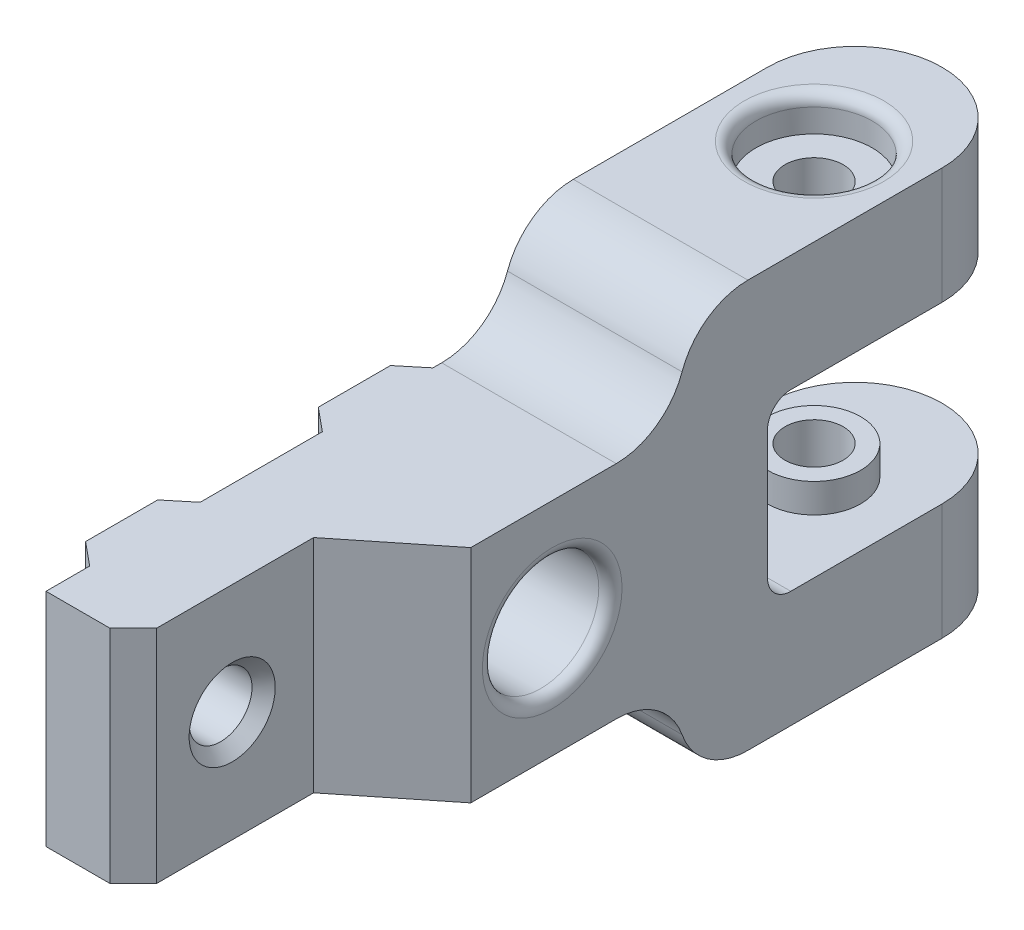
from build123d import *

# Parameters (mm, degrees)
SKETCH_1_W               = 59
SKETCH_1_H               = 15
EXTRUDE_1_DEPTH          = 5
SKETCH_2_R               = 2.5
CUT_EXTRUDE_1_DEPTH      = 31.84639363
SKETCH_3_W               = 9.5
SKETCH_3_H               = 15
EXTRUDE_2_DEPTH          = 2
CUT_EXTRUDE_2_DEPTH      = 34.826764551
CUT_EXTRUDE_2_DEPTH_BACK = 34.826764551
SKETCH_5_R               = 2.5
CUT_EXTRUDE_3_DEPTH      = 32.232995373
SKETCH_7_R               = 2.5
CUT_EXTRUDE_4_DEPTH      = 32.232995373
SKETCH_8_W               = 15
SKETCH_8_H               = 15
EXTRUDE_3_DEPTH          = 38.5
SKETCH_13_W              = 9.5
SKETCH_13_H              = 15
EXTRUDE_4_DEPTH          = 2
CUT_EXTRUDE_5_DEPTH      = 55.658027773
SKETCH_15_R              = 2.5
CUT_EXTRUDE_6_DEPTH      = 62.276014883
CUT_EXTRUDE_7_DEPTH      = 55.658027773
CHAMFER_1_SIZE           = 2
CHAMFER_2_SIZE           = 2
CHAMFER_3_SIZE           = 1
CHAMFER_4_SIZE           = 1
CHAMFER_5_SIZE           = 1
CHAMFER_6_SIZE           = 1
CUT_EXTRUDE_8_DEPTH      = 55.658027773
EXTRUDE_5_DEPTH          = 15
SKETCH_19_R              = 2.5
CUT_EXTRUDE_9_DEPTH      = 62.276014883
SKETCH_20_R              = 4
CUT_EXTRUDE_10_DEPTH     = 5
EXTRUDE_6_DEPTH          = 15
CUT_EXTRUDE_11_DEPTH     = 15
SKETCH_23_R              = 11
CUT_EXTRUDE_12_DEPTH     = 55.658027773
FILLET_2_R               = 7
SKETCH_24_W              = 4
SKETCH_24_H              = 15
CUT_EXTRUDE_14_DEPTH     = 55.658027773
EXTRUDE_7_DEPTH          = 15
SKETCH_26_R              = 2.5
CUT_EXTRUDE_15_DEPTH     = 55.658027773
FILLET_3_RADIUS          = 7.5
FILLET_3_LENGTH          = 15
SKETCH_27_W              = 25.515520857
SKETCH_27_H              = 10.25
CUT_EXTRUDE_16_DEPTH     = 55.658027773
SKETCH_29_R              = 2.65
CUT_EXTRUDE_17_DEPTH     = 48.302219821
SKETCH_30_R              = 2.5
EXTRUDE_8_DEPTH          = 20
SKETCH_31_W              = 11
SKETCH_31_H              = 15
CUT_EXTRUDE_18_DEPTH     = 55.198708472
EXTRUDE_9_REACH          = 56.199
SKETCH_35_R              = 3
SKETCH_35_R_2            = 2.75
SKETCH_36_W              = 10.932925362
SKETCH_36_H              = 11.739598214
EXTRUDE_10_DEPTH         = 4
SKETCH_37_R              = 4.898045624
CUT_EXTRUDE_19_DEPTH     = 7.5
CUT_EXTRUDE_20_DEPTH     = 8
CUT_EXTRUDE_21_DEPTH     = 8
SKETCH_39_W              = 7.820563766
SKETCH_39_H              = 12.633218391
EXTRUDE_11_DEPTH         = 8
CUT_EXTRUDE_22_DEPTH     = 55.198708472
SKETCH_41_R              = 5
CUT_EXTRUDE_23_DEPTH     = 8
FILLET_4_R               = 1
CHAMFER_8_SIZE           = 1
FILLET_6_R               = 6
SKETCH_43_W              = 13
SKETCH_43_H              = 15
CUT_EXTRUDE_25_DEPTH     = 55.198708472
SKETCH_46_W              = 2
SKETCH_46_H              = 15
CUT_EXTRUDE_26_DEPTH     = 55.198708472
FILLET_8_R               = 2
SKETCH_48_R              = 4
SKETCH_48_R_2            = 2.5
EXTRUDE_12_DEPTH         = 15
SKETCH_49_W              = 15.94941223
SKETCH_49_H              = 10
CUT_EXTRUDE_27_DEPTH     = 55.198708472
EXTRUDE_14_DEPTH         = 8
EXTRUDE_14_DEPTH_BACK    = 8
SKETCH_51_R              = 2.5
SKETCH_52_R              = 2.5
CUT_EXTRUDE_28_DEPTH     = 8
FILLET_9_R               = 6
SKETCH_54_R              = 4.75
CUT_EXTRUDE_29_DEPTH     = 2
CUT_EXTRUDE_30_DEPTH     = 4
SKETCH_56_R              = 5
CUT_EXTRUDE_31_DEPTH     = 3
FILLET_10_R              = 1


with BuildPart() as part:
    # Эскиз1 → Бобышка-Вытянуть1 (new body)
    with BuildSketch(Plane.XY):
        Rectangle(SKETCH_1_W, SKETCH_1_H)
    extrude(amount=EXTRUDE_1_DEPTH)

    # Эскиз2 → Вырез-Вытянуть1 (cut, through all)
    with BuildSketch(Plane(origin=(0, 0, 0), x_dir=(-1, 0, 0), z_dir=(0, 0, -1))):
        with BuildLine():
            ThreePointArc((23.5, 0), (21, 2.5), (18.5, 0))
            Line((18.5, 0), (21, 0))
            Line((21, 0), (23.5, 0))
        make_face()
        with BuildLine():
            Line((21, 0), (18.5, 0))
            ThreePointArc((18.5, 0), (21, -2.5), (23.5, 0))
            Line((23.5, 0), (21, 0))
        make_face()
        with Locations((-21, 0)):
            Circle(SKETCH_2_R)
    extrude(amount=-CUT_EXTRUDE_1_DEPTH, mode=Mode.SUBTRACT)

    # Эскиз3 → Бобышка-Вытянуть2 (add)
    with BuildSketch(Plane.XY.offset(5)):
        with Locations((-21, 0)):
            Rectangle(SKETCH_3_W, SKETCH_3_H)
        with Locations((21, 0)):
            Rectangle(SKETCH_3_W, SKETCH_3_H)
    extrude(amount=EXTRUDE_2_DEPTH)

    # Эскиз4 → Вырез-Вытянуть2 (cut, two sides: drawn at the far end of the back side and taken through both)
    with BuildSketch(Plane.XZ.offset(7.5).offset(-CUT_EXTRUDE_2_DEPTH_BACK)):
        Polygon((-16.25, 7), (-17.9, 7), (-16.25, 5), align=None)
        Polygon((-25.75, 5), (-24.1, 7), (-25.75, 7), align=None)
    extrude(amount=CUT_EXTRUDE_2_DEPTH + CUT_EXTRUDE_2_DEPTH_BACK, mode=Mode.SUBTRACT)

    # Эскиз5 → Вырез-Вытянуть3 (cut, through all)
    with BuildSketch(Plane(origin=(0, 0, 0), x_dir=(-1, 0, 0), z_dir=(0, 0, -1))):
        with Locations((21, 0)):
            Circle(SKETCH_5_R)
    extrude(amount=-CUT_EXTRUDE_3_DEPTH, mode=Mode.SUBTRACT)

    # Эскиз7 → Вырез-Вытянуть4 (cut, through all)
    with BuildSketch(Plane(origin=(0, 0, 0), x_dir=(-1, 0, 0), z_dir=(0, 0, -1))):
        with Locations((-21, 0)):
            Circle(SKETCH_7_R)
    extrude(amount=-CUT_EXTRUDE_4_DEPTH, mode=Mode.SUBTRACT)

    # Эскиз8 → Бобышка-Вытянуть3 (add)
    with BuildSketch(Plane.XY.offset(5)):
        with Locations((-3.5, 0)):
            Rectangle(SKETCH_8_W, SKETCH_8_H)
    extrude(amount=EXTRUDE_3_DEPTH)

    # Эскиз13 → Бобышка-Вытянуть4 (add)
    with BuildSketch(Plane.ZY.offset(11)):
        with Locations((15, 0)):
            Rectangle(SKETCH_13_W, SKETCH_13_H)
        with Locations((35, 0)):
            Rectangle(SKETCH_13_W, SKETCH_13_H)
    extrude(amount=EXTRUDE_4_DEPTH)

    # Эскиз14 → Вырез-Вытянуть5 (cut, through all)
    with BuildSketch(Plane.XZ.offset(7.5)):
        Polygon((-13, 39.75), (-13, 38.1), (-11, 39.75), align=None)
        Polygon((-11, 30.25), (-13, 31.9), (-13, 30.25), align=None)
        Polygon((-13, 19.75), (-13, 18.1), (-11, 19.75), align=None)
        Polygon((-11, 10.25), (-13, 11.9), (-13, 10.25), align=None)
    extrude(amount=-CUT_EXTRUDE_5_DEPTH, mode=Mode.SUBTRACT)

    # Эскиз15 → Вырез-Вытянуть6 (cut, through all)
    with BuildSketch(Plane.ZY.offset(13)):
        with Locations((15, 0)):
            Circle(SKETCH_15_R)
        with Locations((35, 0)):
            Circle(SKETCH_15_R)
    extrude(amount=-CUT_EXTRUDE_6_DEPTH, mode=Mode.SUBTRACT)

    # Эскиз16 → Вырез-Вытянуть7 (cut, through all)
    with BuildSketch(Plane(origin=(0, 7.5, 0), x_dir=(1, 0, 0), z_dir=(0, 1, 0))):
        Polygon((4, -43.5), (4, -22), (-3.5, -28), (-3.5, -43.5), align=None)
    extrude(amount=-CUT_EXTRUDE_7_DEPTH, mode=Mode.SUBTRACT)

    # Фаска1
    chamfer_1_edges = [part.edges().sort_by_distance(p)[0] for p in [
        (-3.5, 0, 43.5),
    ]]
    chamfer(chamfer_1_edges, length=CHAMFER_1_SIZE)

    # Фаска2
    chamfer_2_edges = [part.edges().sort_by_distance(p)[0] for p in [
        (29.5, 0, 5),
    ]]
    chamfer(chamfer_2_edges, length=CHAMFER_2_SIZE)

    # Фаска3
    chamfer_3_edges = [part.edges().sort_by_distance(p)[0] for p in [
        (25.75, 0, 7),
    ]]
    chamfer(chamfer_3_edges, length=CHAMFER_3_SIZE)

    # Фаска4
    chamfer_4_edges = [part.edges().sort_by_distance(p)[0] for p in [
        (16.25, 0, 7),
    ]]
    chamfer(chamfer_4_edges, length=CHAMFER_4_SIZE)

    # Фаска5
    chamfer_5_edges = [part.edges().sort_by_distance(p)[0] for p in [
        (29.5, 0, 0),
    ]]
    chamfer(chamfer_5_edges, length=CHAMFER_5_SIZE)

    # Фаска6
    chamfer_6_edges = [part.edges().sort_by_distance(p)[0] for p in [
        (-29.5, 0, 0),
    ]]
    chamfer(chamfer_6_edges, length=CHAMFER_6_SIZE)

    # Эскиз17 → Вырез-Вытянуть8 (cut, through all)
    with BuildSketch(Plane.XZ.offset(7.5)):
        Polygon((-11, 5), (4, 5), (4, 22), (-3.5, 28), (-3.5, 41.5), (-5.5, 43.5), (-11, 43.5), (-11, 39.75), (-13, 38.1), (-13, 31.9), (-11, 30.25), (-11, 19.75), (-13, 18.1), (-13, 11.9), (-11, 10.25), align=None)
    extrude(amount=-CUT_EXTRUDE_8_DEPTH, mode=Mode.SUBTRACT)

    # Эскиз18 → Бобышка-Вытянуть5 (add)
    with BuildSketch(Plane.XZ.offset(7.5)):
        Polygon((-11, 5), (4, 5), (4, 22), (-3.5, 28), (-3.5, 41.5), (-5.5, 43.5), (-11, 43.5), (-11, 39.75), (-13, 38.1), (-13, 31.9), (-11, 30.25), (-11, 19.75), (-13, 18.1), (-13, 11.9), (-11, 10.25), align=None)
    extrude(amount=-EXTRUDE_5_DEPTH)

    # Эскиз19 → Вырез-Вытянуть9 (cut, through all)
    with BuildSketch(Plane.ZY.offset(13)):
        with Locations((15, 0)):
            Circle(SKETCH_19_R)
        with Locations((35, 0)):
            Circle(SKETCH_19_R)
    extrude(amount=-CUT_EXTRUDE_9_DEPTH, mode=Mode.SUBTRACT)

    # Эскиз20 → Вырез-Вытянуть10 (cut)
    with BuildSketch(Plane(origin=(4, 0, 0), x_dir=(0, 0, -1), z_dir=(1, 0, 0))):
        with Locations((-15, 0)):
            Circle(SKETCH_20_R)
    extrude(amount=-CUT_EXTRUDE_10_DEPTH, mode=Mode.SUBTRACT)

    # Эскиз21 → Бобышка-Вытянуть6 (add)
    with BuildSketch(Plane(origin=(0, 7.5, 0), x_dir=(1, 0, 0), z_dir=(0, 1, 0))):
        with BuildLine():
            Line((15, 15), (15, 0))
            Line((15, 0), (-15, 0))
            Line((-15, 0), (-15, 15))
            ThreePointArc((-15, 15), (0, 30), (15, 15))
        make_face()
    extrude(amount=-EXTRUDE_6_DEPTH)

    # Эскиз22 → Вырез-Вытянуть11 (cut)
    with BuildSketch(Plane(origin=(0, 7.5, 0), x_dir=(1, 0, 0), z_dir=(0, 1, 0))):
        Polygon((15, 0), (15, -5), (16.25, -5), (16.25, -6), (17.25, -7), (24.75, -7), (25.75, -6), (25.75, -5), (27.5, -5), (29.5, -3), (29.5, -1), (28.5, 0), align=None)
    extrude(amount=-CUT_EXTRUDE_11_DEPTH, mode=Mode.SUBTRACT)

    # Эскиз23 → Вырез-Вытянуть12 (cut, through all)
    with BuildSketch(Plane(origin=(0, 7.5, 0), x_dir=(1, 0, 0), z_dir=(0, 1, 0))):
        with Locations(Location((0, 15, 0), (0, 0, 270))):
            Circle(SKETCH_23_R)
    extrude(amount=-CUT_EXTRUDE_12_DEPTH, mode=Mode.SUBTRACT)

    # Скругление2
    fillet_2_edges = [part.edges().sort_by_distance(p)[0] for p in [
        (15, 0, 5),
    ]]
    fillet(fillet_2_edges, radius=FILLET_2_R)

    # Эскиз24 → Вырез-Вытянуть14 (cut, through all)
    with BuildSketch(Plane.XZ.offset(7.5)):
        with BuildLine():
            Line((11, -15), (15, -15))
            Line((15, -15), (15, -2))
            ThreePointArc((15, -2), (12.949747468, 2.949747468), (8, 5))
            Line((8, 5), (4, 5))
            Line((4, 5), (4, -4.753049234))
            ThreePointArc((4, -4.753049234), (9.082951062, -8.795163177), (11, -15))
        make_face()
        with BuildLine():
            ThreePointArc((-10.198039027, -26), (6.001225483, -28.747192175), (15, -15))
            Line((15, -15), (11, -15))
            ThreePointArc((11, -15), (9.082951062, -21.204836823), (4, -25.246950766))
            Line((4, -25.246950766), (4, -26))
            Line((4, -26), (0, -26))
            Line((0, -26), (-10.198039027, -26))
        make_face()
        with BuildLine():
            ThreePointArc((-15, -15), (-13.964240044, -20.477225575), (-11, -25.198039027))
            Line((-11, -25.198039027), (-11, -15))
            Line((-11, -15), (-15, -15))
        make_face()
        with Locations((-13, -7.5)):
            Rectangle(SKETCH_24_W, SKETCH_24_H)
    extrude(amount=-CUT_EXTRUDE_14_DEPTH, mode=Mode.SUBTRACT)


with BuildPart() as cut_extrude_14_piece_1:
    # of the separate pieces the step leaves, piece 1, a body of its own (cut_extrude_14_pieces)
    add(part.part.solids().sort_by_distance((4, 7.5, 22))[0])



with BuildPart() as cut_extrude_14_piece_2:
    # of the separate pieces the step leaves, piece 2, a body of its own (cut_extrude_14_pieces)
    add(part.part.solids().sort_by_distance((-10.198039027, 7.5, -26))[0])


with BuildPart() as cut_extrude_14_piece_3:
    # of the separate pieces the step leaves, piece 3, a body of its own (cut_extrude_14_pieces)
    add(part.part.solids().sort_by_distance((4, 7.5, -26))[0])


with BuildPart() as cut_extrude_14_piece_1_1:
    add(cut_extrude_14_piece_1.part)

    add(cut_extrude_14_piece_2.part)  # Бобышка-Вытянуть7 merges Вырез-Вытянуть14 piece 2

    add(cut_extrude_14_piece_3.part)  # Бобышка-Вытянуть7 merges Вырез-Вытянуть14 piece 3
    # Эскиз25 → Бобышка-Вытянуть7 (add, through all)
    with BuildSketch(Plane.XZ.offset(7.5)):
        Polygon((4, -4.753049234), (4, -26), (-11, -26), (-11, 0), (4, 0), align=None)
    extrude(amount=-EXTRUDE_7_DEPTH)

    # Эскиз26 → Вырез-Вытянуть15 (cut, through all)
    with BuildSketch(Plane.XZ.offset(7.5)):
        with Locations(Location((-3.5, -15, 0), (0, 0, 270))):
            Circle(SKETCH_26_R)
    extrude(amount=-CUT_EXTRUDE_15_DEPTH, mode=Mode.SUBTRACT)

    # Скругление3: full round fillet: the end face becomes a half cylinder, R = half its width
    fillet_3_face = Plane((-3.5, 0, -26), x_dir=(0, -1, 0), z_dir=(0, 0, -1))  # on the end face: x along it, z out of the body
    fillet_3_slab = fillet_3_face.offset(-FILLET_3_RADIUS / 2) * Box(FILLET_3_LENGTH, 2 * FILLET_3_RADIUS, FILLET_3_RADIUS, mode=Mode.PRIVATE)  # the body's end, R deep
    fillet_3_round = Plane((-3.5, 0, -18.5), x_dir=(0, 0, -1), z_dir=(0, -1, 0)) * Cylinder(FILLET_3_RADIUS, FILLET_3_LENGTH, mode=Mode.PRIVATE)  # its axis R under the face
    add(fillet_3_slab - fillet_3_round, mode=Mode.SUBTRACT)

    # Эскиз27 → Вырез-Вытянуть16 (cut, through all)
    with BuildSketch(Plane.XZ.offset(7.5)):
        with Locations((-23.757760429, 5.125)):
            Rectangle(SKETCH_27_W, SKETCH_27_H)
    extrude(amount=-CUT_EXTRUDE_16_DEPTH, mode=Mode.SUBTRACT)

    # Эскиз29 → Вырез-Вытянуть17 (cut, through all)
    with BuildSketch(Plane(origin=(4, 0, 0), x_dir=(0, 0, -1), z_dir=(1, 0, 0))):
        with Locations((-15, 0)):
            Circle(SKETCH_29_R)
        with Locations((-35, 0)):
            Circle(SKETCH_29_R)
    extrude(amount=-CUT_EXTRUDE_17_DEPTH, mode=Mode.SUBTRACT)

    # Эскиз30 → Бобышка-Вытянуть8 (add)
    with BuildSketch(Plane.XZ.offset(7.5)):
        with BuildLine():
            Line((4, -18.5), (4, 22))
            Line((4, 22), (-3.5, 28))
            Line((-3.5, 28), (-3.5, 41.5))
            Line((-3.5, 41.5), (-5.5, 43.5))
            Line((-5.5, 43.5), (-11, 43.5))
            Line((-11, 43.5), (-11, 39.75))
            Line((-11, 39.75), (-13, 38.1))
            Line((-13, 38.1), (-13, 31.9))
            Line((-13, 31.9), (-11, 30.25))
            Line((-11, 30.25), (-11, 19.75))
            Line((-11, 19.75), (-13, 18.1))
            Line((-13, 18.1), (-13, 11.9))
            Line((-13, 11.9), (-11, 10.25))
            Line((-11, 10.25), (-11, -18.5))
            ThreePointArc((-11, -18.5), (-3.5, -26), (4, -18.5))
        make_face()
        with Locations(Location((-3.5, -15, 0), (0, 0, 270))):
            Circle(SKETCH_30_R, mode=Mode.SUBTRACT)
    extrude(amount=EXTRUDE_8_DEPTH)

    # Эскиз31 → Вырез-Вытянуть18 (cut, through all)
    with BuildSketch(Plane(origin=(4, 0, 0), x_dir=(0, 0, -1), z_dir=(1, 0, 0))):
        with Locations((24, -9.999815)):
            Rectangle(SKETCH_31_W, SKETCH_31_H)
        with Locations((13, -9.999815)):
            Rectangle(SKETCH_31_W, SKETCH_31_H)
    extrude(amount=-CUT_EXTRUDE_18_DEPTH, mode=Mode.SUBTRACT)

    # Бобышка-Вытянуть9: up to this face of the body (flat: up to its plane)
    extrude_9_end = Plane(cut_extrude_14_piece_1_1.part.faces().sort_by_distance((-13, -11.131734996, 15))[0])
    # Эскиз35 → Бобышка-Вытянуть9 (add, up to the picked face)
    with BuildSketch(Plane(origin=(4, 0, 0), x_dir=(0, 0, -1), z_dir=(1, 0, 0)), mode=Mode.PRIVATE) as extrude_9_sk1:
        with Locations((-15, 0)):
            Circle(SKETCH_35_R)
    extrude_9_tool1 = split(extrude(extrude_9_sk1.sketch, amount=-EXTRUDE_9_REACH, mode=Mode.PRIVATE), bisect_by=extrude_9_end, keep=Keep.BOTH, mode=Mode.PRIVATE)
    # Эскиз35 → Бобышка-Вытянуть9 (add, up to the picked face)
    with BuildSketch(Plane(origin=(4, 0, 0), x_dir=(0, 0, -1), z_dir=(1, 0, 0)), mode=Mode.PRIVATE) as extrude_9_sk2:
        with Locations((-35, 0)):
            Circle(SKETCH_35_R_2)
    extrude_9_tool2 = split(extrude(extrude_9_sk2.sketch, amount=-EXTRUDE_9_REACH, mode=Mode.PRIVATE), bisect_by=extrude_9_end, keep=Keep.BOTH, mode=Mode.PRIVATE)
    add(extrude_9_tool1.solids().sort_by(Axis((4, 0, 15), (-1, 0, 0)))[0])
    add(extrude_9_tool2.solids().sort_by(Axis((4, 0, 35), (-1, 0, 0)))[0])

    # Эскиз36 → Бобышка-Вытянуть10 (add)
    with BuildSketch(Plane(origin=(4, 0, 0), x_dir=(0, 0, -1), z_dir=(1, 0, 0))):
        with Locations((-15, 0)):
            Rectangle(SKETCH_36_W, SKETCH_36_H)
    extrude(amount=-EXTRUDE_10_DEPTH)

    # Эскиз37 → Вырез-Вытянуть19 (cut)
    with BuildSketch(Plane(origin=(4, 0, 0), x_dir=(0, 0, -1), z_dir=(1, 0, 0))):
        with Locations((-35, 0)):
            Circle(SKETCH_37_R)
    extrude(amount=-CUT_EXTRUDE_19_DEPTH, mode=Mode.SUBTRACT)

    # Эскиз33 → Вырез-Вытянуть20 (cut)
    with BuildSketch(Plane(origin=(0, 7.5, 0), x_dir=(1, 0, 0), z_dir=(0, 1, 0))):
        Polygon((-11, -39.75), (-11, -43.5), (-5.5, -43.5), (-3.5, -41.5), (-3.5, -28), (4, -22), (4, -3.5), (-11, -3.5), (-11, -10.25), (-13, -11.9), (-13, -18.1), (-11, -19.75), (-11, -30.25), (-13, -31.9), (-13, -38.1), align=None)
    extrude(amount=-CUT_EXTRUDE_20_DEPTH, mode=Mode.SUBTRACT)

    # Эскиз38 → Вырез-Вытянуть21 (cut)
    with BuildSketch(Plane.XZ.offset(27.5)):
        Polygon((-5.5, 43.5), (-11, 43.5), (-11, 39.75), (-13, 38.1), (-13, 31.9), (-11, 30.25), (-11, 19.75), (-13, 18.1), (-13, 11.9), (-11, 10.25), (-11, 3.5), (4, 3.5), (4, 22), (-3.5, 28), (-3.5, 41.5), align=None)
    extrude(amount=-CUT_EXTRUDE_21_DEPTH, mode=Mode.SUBTRACT)

    # Эскиз39 → Бобышка-Вытянуть11 (add)
    with BuildSketch(Plane(origin=(0, -0.5, 0), x_dir=(1, 0, 0), z_dir=(0, 1, 0))):
        with Locations((-1.703124284, -13.938643268)):
            Rectangle(SKETCH_39_W, SKETCH_39_H)
    extrude(amount=-EXTRUDE_11_DEPTH)

    # Эскиз40 → Вырез-Вытянуть22 (cut, through all)
    with BuildSketch(Plane.ZY.offset(13)):
        with BuildLine():
            ThreePointArc((15, -7.3), (12.3, -10), (15, -12.7))
            Line((15, -12.7), (15, -10))
            Line((15, -10), (15, -7.3))
        make_face()
        with BuildLine():
            Line((15, -10), (15, -12.7))
            ThreePointArc((15, -12.7), (16.909188309, -11.909188309), (17.7, -10))
            Line((17.7, -10), (15, -10))
        make_face()
        with BuildLine():
            Line((15, -7.3), (15, -10))
            Line((15, -10), (17.7, -10))
            ThreePointArc((17.7, -10), (16.909188309, -8.090811691), (15, -7.3))
        make_face()
        with BuildLine():
            ThreePointArc((35, -7.3), (33.090811691, -8.090811691), (32.3, -10))
            Line((32.3, -10), (35, -10))
            Line((35, -10), (35, -7.3))
        make_face()
        with BuildLine():
            Line((35, -10), (32.3, -10))
            ThreePointArc((32.3, -10), (33.090811691, -11.909188309), (35, -12.7))
            Line((35, -12.7), (35, -10))
        make_face()
        with BuildLine():
            Line((35, -7.3), (35, -10))
            Line((35, -10), (37.7, -10))
            ThreePointArc((37.7, -10), (36.909188309, -8.090811691), (35, -7.3))
        make_face()
        with BuildLine():
            Line((37.7, -10), (35, -10))
            Line((35, -10), (35, -12.7))
            ThreePointArc((35, -12.7), (36.909188309, -11.909188309), (37.7, -10))
        make_face()
    extrude(amount=-CUT_EXTRUDE_22_DEPTH, mode=Mode.SUBTRACT)

    # Эскиз41 → Вырез-Вытянуть23 (cut)
    with BuildSketch(Plane(origin=(4, 0, 0), x_dir=(0, 0, -1), z_dir=(1, 0, 0))):
        with Locations((-15, -10)):
            Circle(SKETCH_41_R)
    extrude(amount=-CUT_EXTRUDE_23_DEPTH, mode=Mode.SUBTRACT)

    # Скругление4
    fillet_4_edges = [cut_extrude_14_piece_1_1.edges().sort_by_distance(p)[0] for p in [
        (4, -10, 20),
    ]]
    fillet(fillet_4_edges, radius=FILLET_4_R)

    # Фаска8
    chamfer_8_edges = [cut_extrude_14_piece_1_1.edges().sort_by_distance(p)[0] for p in [
        (-3.5, -10, 32.3),
        (-4, -7.3, 15),
    ]]
    chamfer(chamfer_8_edges, length=CHAMFER_8_SIZE)

    # Скругление6
    fillet_6_edges = [cut_extrude_14_piece_1_1.edges().sort_by_distance(p)[0] for p in [
        (-3.5, -0.5, 3.5),
        (-3.5, -19.5, 3.5),
    ]]
    fillet(fillet_6_edges, radius=FILLET_6_R)

    # Эскиз43 → Вырез-Вытянуть25 (cut, through all)
    with BuildSketch(Plane(origin=(4, 0, 0), x_dir=(0, 0, -1), z_dir=(1, 0, 0))):
        with Locations((12, -9.999815)):
            Rectangle(SKETCH_43_W, SKETCH_43_H)
    extrude(amount=-CUT_EXTRUDE_25_DEPTH, mode=Mode.SUBTRACT)

    # Эскиз46 → Вырез-Вытянуть26 (cut, through all)
    with BuildSketch(Plane(origin=(4, 0, 0), x_dir=(0, 0, -1), z_dir=(1, 0, 0))):
        with Locations((4.5, -9.999815)):
            Rectangle(SKETCH_46_W, SKETCH_46_H)
    extrude(amount=-CUT_EXTRUDE_26_DEPTH, mode=Mode.SUBTRACT)

    # Скругление8
    fillet_8_edges = [cut_extrude_14_piece_1_1.edges().sort_by_distance(p)[0] for p in [
        (-3.5, -17.499815, -3.5),
        (-3.5, -2.499815, -3.5),
    ]]
    fillet(fillet_8_edges, radius=FILLET_8_R)

    # Эскиз48 → Бобышка-Вытянуть12 (add)
    with BuildSketch(Plane.XZ.offset(2.499815)):
        with Locations(Location((-3.5, -15, 0), (0, 0, 90))):
            Circle(SKETCH_48_R)
        with Locations(Location((-3.5, -15, 0), (0, 0, 270))):
            Circle(SKETCH_48_R_2, mode=Mode.SUBTRACT)
    extrude(amount=EXTRUDE_12_DEPTH)

    # Эскиз49 → Вырез-Вытянуть27 (cut, through all)
    with BuildSketch(Plane(origin=(4, 0, 0), x_dir=(0, 0, -1), z_dir=(1, 0, 0))):
        with Locations((15.518106741, -9.999815)):
            Rectangle(SKETCH_49_W, SKETCH_49_H)
    extrude(amount=-CUT_EXTRUDE_27_DEPTH, mode=Mode.SUBTRACT)

    # Эскиз51 → Бобышка-Вытянуть14 (add, two sides: drawn at the far end of the back side and taken through both)
    with BuildSketch(Plane(origin=(0, 7.5, 0), x_dir=(1, 0, 0), z_dir=(0, 1, 0)).offset(-EXTRUDE_14_DEPTH_BACK)):
        with BuildLine():
            Line((-11, -3.5), (4, -3.5))
            Line((4, -3.5), (4, 18.5))
            ThreePointArc((4, 18.5), (-3.5, 26), (-11, 18.5))
            Line((-11, 18.5), (-11, -3.5))
        make_face()
        with Locations(Location((-3.5, 15, 0), (0, 0, 90))):
            Circle(SKETCH_51_R, mode=Mode.SUBTRACT)
    extrude(amount=EXTRUDE_14_DEPTH + EXTRUDE_14_DEPTH_BACK)

    # Эскиз52 → Вырез-Вытянуть28 (cut)
    with BuildSketch(Plane(origin=(0, 15.5, 0), x_dir=(1, 0, 0), z_dir=(0, 1, 0))):
        with BuildLine():
            Line((-11, 18.5), (-11, -3.5))
            Line((-11, -3.5), (4, -3.5))
            Line((4, -3.5), (4, 18.5))
            ThreePointArc((4, 18.5), (-3.5, 26), (-11, 18.5))
        make_face()
        with Locations(Location((-3.5, 15, 0), (0, 0, 90))):
            Circle(SKETCH_52_R, mode=Mode.SUBTRACT)
    extrude(amount=-CUT_EXTRUDE_28_DEPTH, mode=Mode.SUBTRACT)

    # Скругление9
    fillet_9_edges = [cut_extrude_14_piece_1_1.edges().sort_by_distance(p)[0] for p in [
        (-3.5, 7.5, 3.5),
        (-3.5, -27.5, 3.5),
    ]]
    fillet(fillet_9_edges, radius=FILLET_9_R)

    # Эскиз54 → Вырез-Вытянуть29 (cut)
    with BuildSketch(Plane.ZY.offset(13)):
        with Locations((15, -10)):
            Circle(SKETCH_54_R)
        with Locations((35, -10)):
            Circle(SKETCH_54_R)
    extrude(amount=-CUT_EXTRUDE_29_DEPTH, mode=Mode.SUBTRACT)

    # Эскиз55 → Вырез-Вытянуть30 (cut)
    with BuildSketch(Plane.XZ.offset(27.5)):
        Polygon((-3.5, -10.150257739), (-7.7, -12.575128869), (-7.7, -17.424871131), (-3.5, -19.849742261), (0.7, -17.424871131), (0.7, -12.575128869), align=None)
    extrude(amount=-CUT_EXTRUDE_30_DEPTH, mode=Mode.SUBTRACT)

    # Эскиз56 → Вырез-Вытянуть31 (cut)
    with BuildSketch(Plane(origin=(0, 7.5, 0), x_dir=(1, 0, 0), z_dir=(0, 1, 0))):
        with Locations(Location((-3.5, 15, 0), (0, 0, 270))):
            Circle(SKETCH_56_R)
    extrude(amount=-CUT_EXTRUDE_31_DEPTH, mode=Mode.SUBTRACT)

    # Скругление10
    fillet_10_edges = [cut_extrude_14_piece_1_1.edges().sort_by_distance(p)[0] for p in [
        (-3.5, 7.5, -20),
    ]]
    fillet(fillet_10_edges, radius=FILLET_10_R)


solid = cut_extrude_14_piece_1_1.part
